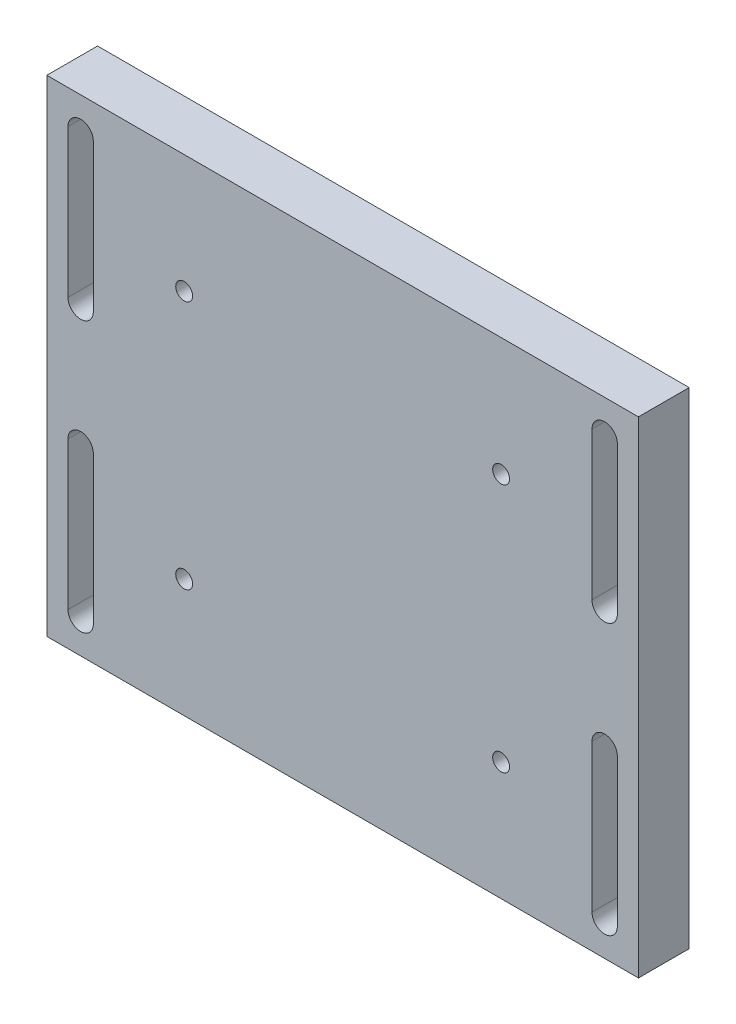
from build123d import *

# Parameters (mm, degrees)
SKETCH1_W               = 140
SKETCH1_H               = 115
BOSS_EXTRUDE1_DEPTH     = 6
CUT_EXTRUDE1_DEPTH      = 12
SKETCH5_R               = 2
CUT_EXTRUDE2_DEPTH      = 12
MIRROR2_COPY_1_DEPTH    = 12
MIRROR2_COPY_2_SKETCH_R = 2
MIRROR2_COPY_2_DEPTH    = 12


with BuildPart() as part:
    # Sketch1 → Boss-Extrude1 (new, symmetric)
    with BuildSketch(Plane.XY):
        Rectangle(SKETCH1_W, SKETCH1_H)
    extrude(amount=BOSS_EXTRUDE1_DEPTH, both=True)

    # Sketch4 → Cut-Extrude1 (cut)
    with BuildSketch(Plane.XY.offset(6)):
        with BuildLine():
            Line((65, 49.5), (65, 14.5))
            ThreePointArc((65, 14.5), (62, 11.5), (59, 14.5))
            Line((59, 14.5), (59, 49.5))
            ThreePointArc((59, 49.5), (62, 52.5), (65, 49.5))
        make_face()
    cut_extrude1 = extrude(amount=-CUT_EXTRUDE1_DEPTH, mode=Mode.SUBTRACT)

    # Sketch5 → Cut-Extrude2 (cut)
    with BuildSketch(Plane.XY.offset(6)):
        with Locations((37.5, 29.5)):
            Circle(SKETCH5_R)
    cut_extrude2 = extrude(amount=-CUT_EXTRUDE2_DEPTH, mode=Mode.SUBTRACT)

    # Mirror1: Cut-Extrude1, Cut-Extrude2 across plane
    add(cut_extrude1.mirror(Plane.ZX), mode=Mode.SUBTRACT)
    add(cut_extrude2.mirror(Plane.ZX), mode=Mode.SUBTRACT)

    # Mirror2: Cut-Extrude1, Cut-Extrude2 across plane
    add(cut_extrude1.mirror(Plane(origin=(0, 0, 0), x_dir=(0, 0, 1), z_dir=(1, 0, 0))), mode=Mode.SUBTRACT)
    add(cut_extrude2.mirror(Plane(origin=(0, 0, 0), x_dir=(0, 0, 1), z_dir=(1, 0, 0))), mode=Mode.SUBTRACT)

    # Mirror2 copy 1 sketch → Mirror2 copy 1 (cut)
    with BuildSketch(Plane(origin=(0, 0, 6), x_dir=(-1, 0, 0), z_dir=(0, 0, 1))):
        with BuildLine():
            Line((65, 49.5), (65, 14.5))
            ThreePointArc((65, 14.5), (62, 11.5), (59, 14.5))
            Line((59, 14.5), (59, 49.5))
            ThreePointArc((59, 49.5), (62, 52.5), (65, 49.5))
        make_face()
    extrude(amount=-MIRROR2_COPY_1_DEPTH, mode=Mode.SUBTRACT)

    # Mirror2 copy 2 sketch → Mirror2 copy 2 (cut)
    with BuildSketch(Plane(origin=(0, 0, 6), x_dir=(-1, 0, 0), z_dir=(0, 0, 1))):
        with Locations((37.5, 29.5)):
            Circle(MIRROR2_COPY_2_SKETCH_R)
    extrude(amount=-MIRROR2_COPY_2_DEPTH, mode=Mode.SUBTRACT)


solid = part.part
